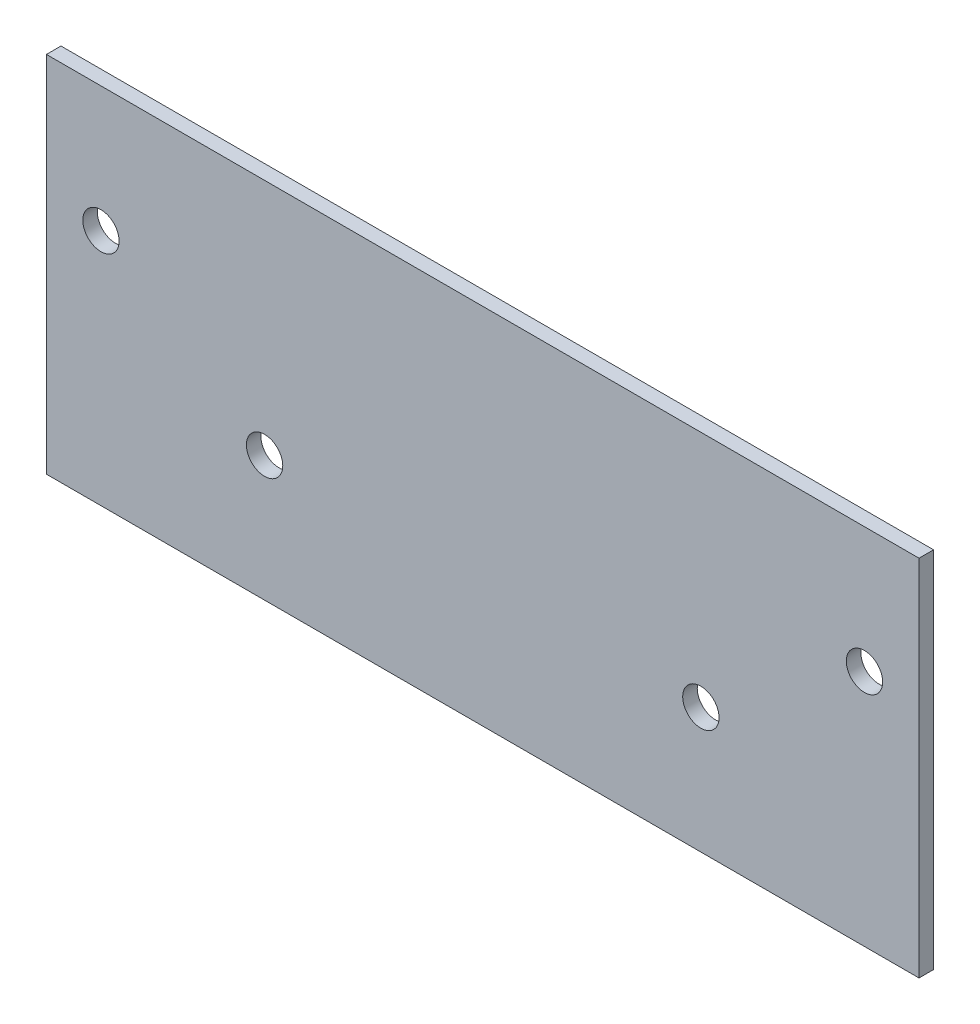
from build123d import *

# Parameters (mm, degrees)
IZIM1_W                     = 120
IZIM1_H                     = 50
IZIM1_R                     = 2.5
Y_KSEKLIK_EKSTR_ZYON1_DEPTH = 2


with BuildPart() as part:
    # Çizim1 → Yükseklik-Ekstrüzyon1 (new body)
    with BuildSketch(Plane.XY):
        Rectangle(IZIM1_W, IZIM1_H)
        with Locations((-52.5, 7.75)):
            Circle(IZIM1_R, mode=Mode.SUBTRACT)
        with Locations(Location((52.5, 7.75, 0), (0, 0, 180))):
            Circle(IZIM1_R, mode=Mode.SUBTRACT)
        with Locations((-30, -7.75)):
            Circle(IZIM1_R, mode=Mode.SUBTRACT)
        with Locations(Location((30, -7.75, 0), (0, 0, 180))):
            Circle(IZIM1_R, mode=Mode.SUBTRACT)
    extrude(amount=Y_KSEKLIK_EKSTR_ZYON1_DEPTH)


solid = part.part
